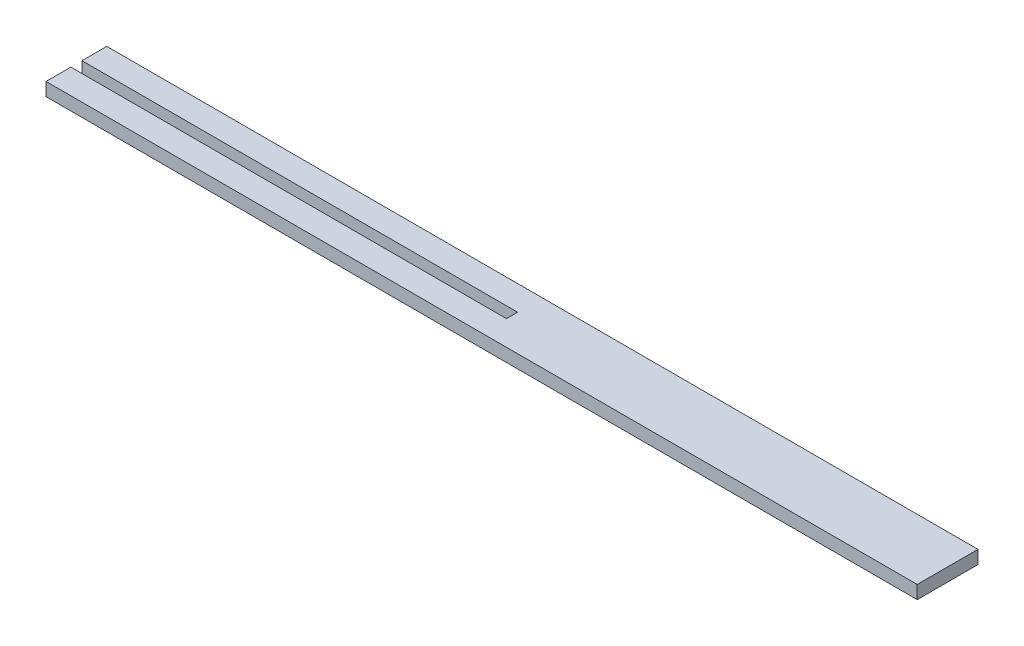
from build123d import *

# Parameters (mm, degrees)
SKETCH1_W           = 86
SKETCH1_H           = 6
BOSS_EXTRUDE1_DEPTH = 1.3
SKETCH2_W           = 43
SKETCH2_H           = 1.1
CUT_EXTRUDE1_DEPTH  = 1.3


with BuildPart() as part:
    # Sketch1 → Boss-Extrude1 (new body)
    with BuildSketch(Plane(origin=(0, 0, 0), x_dir=(1, 0, 0), z_dir=(0, 1, 0))):
        Rectangle(SKETCH1_W, SKETCH1_H)
    extrude(amount=BOSS_EXTRUDE1_DEPTH)

    # Sketch2 → Cut-Extrude1 (cut)
    with BuildSketch(Plane(origin=(0, 1.3, 0), x_dir=(1, 0, 0), z_dir=(0, 1, 0))):
        with Locations((-21.5, 0)):
            Rectangle(SKETCH2_W, SKETCH2_H)
    extrude(amount=-CUT_EXTRUDE1_DEPTH, mode=Mode.SUBTRACT)


solid = part.part
